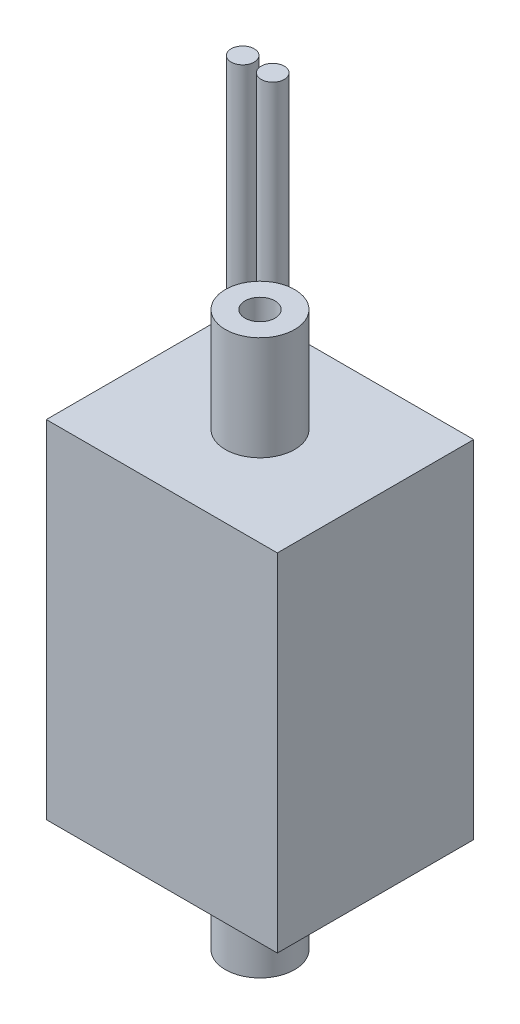
from build123d import *

# Parameters (mm, degrees)
ESQUISSE1_W        = 10
ESQUISSE1_H        = 15
BOSS_EXTRU_1_DEPTH = 8.5
ESQUISSE2_R        = 1.5
ESQUISSE2_R_2      = 0.5
BOSS_EXTRU_2_DEPTH = 4.5
ESQUISSE3_R        = 1.5
ESQUISSE3_R_2      = 0.65
BOSS_EXTRU_3_DEPTH = 4.5
ESQUISSE4_R        = 0.5
BOSS_EXTRU_4_DEPTH = 10


with BuildPart() as part:
    # Esquisse1 → Boss.-Extru.1 (new body)
    with BuildSketch(Plane.XY):
        with Locations((5, 7.5)):
            Rectangle(ESQUISSE1_W, ESQUISSE1_H)
    extrude(amount=BOSS_EXTRU_1_DEPTH)

    # Esquisse2 → Boss.-Extru.2 (add)
    with BuildSketch(Plane.XZ):
        with Locations(Location((5, 4.25, 0), (0, 0, 270))):
            Circle(ESQUISSE2_R)
        with Locations(Location((5, 4.25, 0), (0, 0, 270))):
            Circle(ESQUISSE2_R_2, mode=Mode.SUBTRACT)
    extrude(amount=BOSS_EXTRU_2_DEPTH)

    # Esquisse4 → Boss.-Extru.4 (add)
    with BuildSketch(Plane(origin=(0, 15, 0), x_dir=(1, 0, 0), z_dir=(0, 1, 0))):
        with Locations(Location((0.6, -0.6, 0), (0, 0, 90))):
            Circle(ESQUISSE4_R)
        with Locations(Location((1.9, -0.6, 0), (0, 0, 90))):
            Circle(ESQUISSE4_R)
    extrude(amount=BOSS_EXTRU_4_DEPTH)


with BuildPart() as body_2:
    # Esquisse3 → Boss.-Extru.3 (new body)
    with BuildSketch(Plane(origin=(0, 15, 0), x_dir=(1, 0, 0), z_dir=(0, 1, 0))):
        with Locations(Location((5, -4.25, 0), (0, 0, 270))):
            Circle(ESQUISSE3_R)
        with Locations(Location((5, -4.25, 0), (0, 0, 270))):
            Circle(ESQUISSE3_R_2, mode=Mode.SUBTRACT)
    extrude(amount=BOSS_EXTRU_3_DEPTH)


solid = Compound([part.part, body_2.part])
